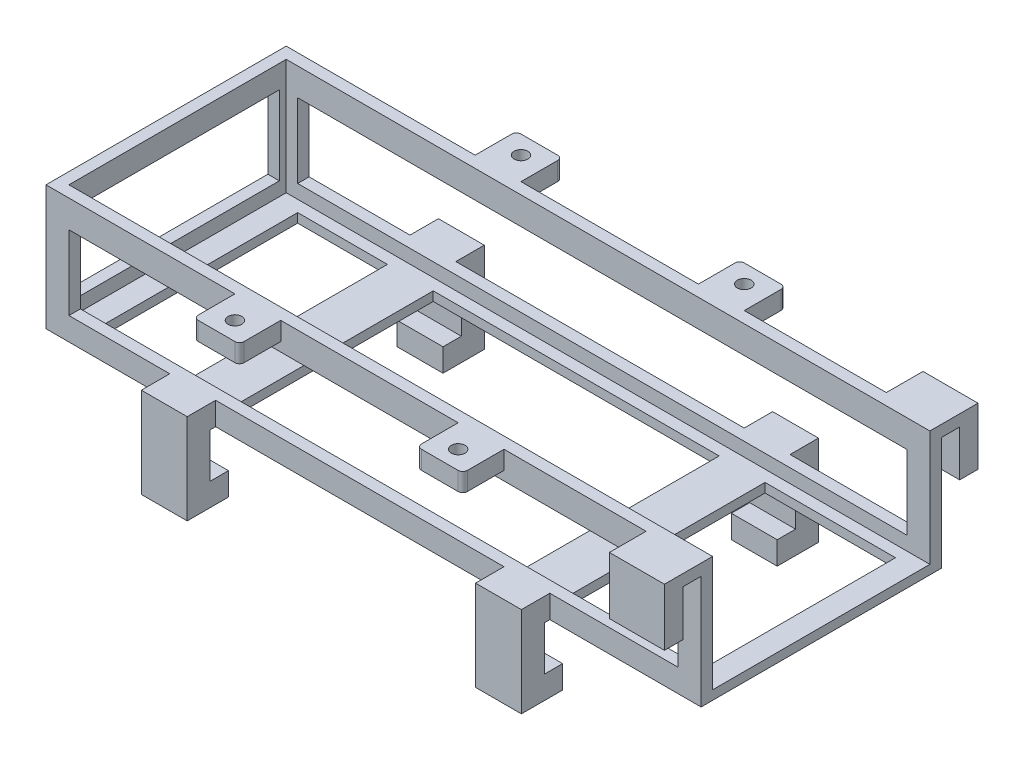
from build123d import *

# Parameters (mm, degrees)
SKETCH1_W            = 145.4
SKETCH1_H            = 52.4
BOSS_EXTRUDE1_DEPTH  = 27.2
SKETCH2_W            = 140.4
SKETCH2_H            = 47.4
CUT_EXTRUDE1_DEPTH   = 25.2
SKETCH3_W            = 46.4
SKETCH3_H            = 25.2
CUT_EXTRUDE2_DEPTH   = 25.2
SKETCH8_W            = 2.5
SKETCH8_H            = 52.4
CUT_EXTRUDE5_DEPTH   = 43
SKETCH9_W            = 44.4
SKETCH9_H            = 17.2
CUT_EXTRUDE6_DEPTH   = 43
SKETCH11_W           = 132.9
SKETCH11_H           = 16.2
CUT_EXTRUDE7_DEPTH   = 59
SKETCH12_W           = 130.4
SKETCH12_H           = 42.4
CUT_EXTRUDE8_DEPTH   = 10
SKETCH16_W           = 12
SKETCH16_H           = 2.5
BOSS_EXTRUDE4_DEPTH  = 8
SKETCH18_W           = 12
SKETCH18_H           = 2.5
BOSS_EXTRUDE6_DEPTH  = 8
SKETCH24_W           = 10
SKETCH24_H           = 5
BOSS_EXTRUDE12_DEPTH = 6.2
SKETCH25_W           = 10
SKETCH25_H           = 5
BOSS_EXTRUDE13_DEPTH = 6.2
SKETCH26_W           = 10
SKETCH26_H           = 5
BOSS_EXTRUDE14_DEPTH = 9.7
SKETCH27_W           = 10
SKETCH27_H           = 9
BOSS_EXTRUDE15_DEPTH = 5
SKETCH28_W           = 10
SKETCH28_H           = 2
BOSS_EXTRUDE16_DEPTH = 42.4
SKETCH29_W           = 10
SKETCH29_H           = 2
BOSS_EXTRUDE17_DEPTH = 42.4
SKETCH30_W           = 12
SKETCH30_H           = 4
BOSS_EXTRUDE18_DEPTH = 10
SKETCH35_W           = 10
SKETCH35_H           = 6
BOSS_EXTRUDE22_DEPTH = 9
SKETCH36_W           = 10
SKETCH36_H           = 6
BOSS_EXTRUDE23_DEPTH = 9
SKETCH37_R           = 1.5
CUT_EXTRUDE10_DEPTH  = 9
SKETCH38_W           = 10
SKETCH38_H           = 2
CUT_EXTRUDE11_DEPTH  = 9
SKETCH39_W           = 10
SKETCH39_H           = 2
CUT_EXTRUDE12_DEPTH  = 9
SKETCH40_W           = 10
SKETCH40_H           = 2
CUT_EXTRUDE13_DEPTH  = 9
FILLET1_R            = 1


with BuildPart() as part:
    # Sketch1 → Boss-Extrude1 (new body)
    with BuildSketch(Plane(origin=(0, 0, 0), x_dir=(1, 0, 0), z_dir=(0, 1, 0))):
        Rectangle(SKETCH1_W, SKETCH1_H)
    extrude(amount=BOSS_EXTRUDE1_DEPTH)

    # Sketch2 → Cut-Extrude1 (cut)
    with BuildSketch(Plane(origin=(0, 27.2, 0), x_dir=(1, 0, 0), z_dir=(0, 1, 0))):
        Rectangle(SKETCH2_W, SKETCH2_H)
    extrude(amount=-CUT_EXTRUDE1_DEPTH, mode=Mode.SUBTRACT)

    # Sketch3 → Cut-Extrude2 (cut)
    with BuildSketch(Plane.ZY.offset(-70.2)):
        with Locations((0.5, 14.6)):
            Rectangle(SKETCH3_W, SKETCH3_H)
    extrude(amount=-CUT_EXTRUDE2_DEPTH, mode=Mode.SUBTRACT)

    # Sketch8 → Cut-Extrude5 (cut)
    with BuildSketch(Plane(origin=(0, 27.2, 0), x_dir=(1, 0, 0), z_dir=(0, 1, 0))):
        with Locations((71.45, 0)):
            Rectangle(SKETCH8_W, SKETCH8_H)
    extrude(amount=-CUT_EXTRUDE5_DEPTH, mode=Mode.SUBTRACT)

    # Sketch9 → Cut-Extrude6 (cut)
    with BuildSketch(Plane.ZY.offset(72.7)):
        with Locations((0, 13.6)):
            Rectangle(SKETCH9_W, SKETCH9_H)
    extrude(amount=-CUT_EXTRUDE6_DEPTH, mode=Mode.SUBTRACT)

    # Sketch11 → Cut-Extrude7 (cut)
    with BuildSketch(Plane(origin=(0, 0, -26.2), x_dir=(-1, 0, 0), z_dir=(0, 0, -1))):
        with Locations((1.25, 13.1)):
            Rectangle(SKETCH11_W, SKETCH11_H)
    extrude(amount=-CUT_EXTRUDE7_DEPTH, mode=Mode.SUBTRACT)

    # Sketch12 → Cut-Extrude8 (cut)
    with BuildSketch(Plane(origin=(0, 0, 0), x_dir=(-1, 0, 0), z_dir=(0, -1, 0))):
        Rectangle(SKETCH12_W, SKETCH12_H)
    extrude(amount=-CUT_EXTRUDE8_DEPTH, mode=Mode.SUBTRACT)

    # Sketch16 → Boss-Extrude4 (add)
    with BuildSketch(Plane(origin=(0, 0, -26.2), x_dir=(-1, 0, 0), z_dir=(0, 0, -1))):
        with Locations((-64.2, 25.95)):
            Rectangle(SKETCH16_W, SKETCH16_H)
    extrude(amount=BOSS_EXTRUDE4_DEPTH)

    # Sketch18 → Boss-Extrude6 (add)
    with BuildSketch(Plane.XY.offset(26.2)):
        with Locations((64.2, 25.95)):
            Rectangle(SKETCH18_W, SKETCH18_H)
    extrude(amount=BOSS_EXTRUDE6_DEPTH)

    # Sketch24 → Boss-Extrude12 (add)
    with BuildSketch(Plane.XY.offset(26.2)):
        with Locations((-40.7, 2.5)):
            Rectangle(SKETCH24_W, SKETCH24_H)
        with Locations((32.2, 2.5)):
            Rectangle(SKETCH24_W, SKETCH24_H)
    extrude(amount=BOSS_EXTRUDE12_DEPTH)

    # Sketch25 → Boss-Extrude13 (add)
    with BuildSketch(Plane(origin=(0, 0, -26.2), x_dir=(-1, 0, 0), z_dir=(0, 0, -1))):
        with Locations((40.7, 2.5)):
            Rectangle(SKETCH25_W, SKETCH25_H)
        with Locations((-32.2, 2.5)):
            Rectangle(SKETCH25_W, SKETCH25_H)
    extrude(amount=BOSS_EXTRUDE13_DEPTH)

    # Sketch26 → Boss-Extrude14 (add)
    with BuildSketch(Plane(origin=(0, 0, 0), x_dir=(-1, 0, 0), z_dir=(0, -1, 0))):
        with Locations((40.7, 29.9)):
            Rectangle(SKETCH26_W, SKETCH26_H)
        with Locations((40.7, -29.9)):
            Rectangle(SKETCH26_W, SKETCH26_H)
        with Locations((-32.2, -29.9)):
            Rectangle(SKETCH26_W, SKETCH26_H)
        with Locations((-32.2, 29.9)):
            Rectangle(SKETCH26_W, SKETCH26_H)
    extrude(amount=BOSS_EXTRUDE14_DEPTH)

    # Sketch27 → Boss-Extrude15 (add)
    with BuildSketch(Plane(origin=(0, -9.7, 0), x_dir=(-1, 0, 0), z_dir=(0, -1, 0))):
        with Locations((40.7, -27.9)):
            Rectangle(SKETCH27_W, SKETCH27_H)
        with Locations((-32.2, -27.9)):
            Rectangle(SKETCH27_W, SKETCH27_H)
        with Locations((40.7, 27.9)):
            Rectangle(SKETCH27_W, SKETCH27_H)
        with Locations((-32.2, 27.9)):
            Rectangle(SKETCH27_W, SKETCH27_H)
    extrude(amount=BOSS_EXTRUDE15_DEPTH)

    # Sketch28 → Boss-Extrude16 (add)
    with BuildSketch(Plane.XY.offset(-21.2)):
        with Locations((-40.62922207, 1)):
            Rectangle(SKETCH28_W, SKETCH28_H)
    extrude(amount=BOSS_EXTRUDE16_DEPTH)

    # Sketch29 → Boss-Extrude17 (add)
    with BuildSketch(Plane.XY.offset(-21.2)):
        with Locations((31.742427041, 1)):
            Rectangle(SKETCH29_W, SKETCH29_H)
    extrude(amount=BOSS_EXTRUDE17_DEPTH)

    # Sketch30 → Boss-Extrude18 (add)
    with BuildSketch(Plane(origin=(0, 24.7, 0), x_dir=(-1, 0, 0), z_dir=(0, -1, 0))):
        with Locations((-64.2, -32.2)):
            Rectangle(SKETCH30_W, SKETCH30_H)
        with Locations((-64.2, 32.2)):
            Rectangle(SKETCH30_W, SKETCH30_H)
    extrude(amount=BOSS_EXTRUDE18_DEPTH)

    # Sketch35 → Boss-Extrude22 (add)
    with BuildSketch(Plane(origin=(0, 0, -26.2), x_dir=(-1, 0, 0), z_dir=(0, 0, -1))):
        with Locations((-22.214363523, 24.2)):
            Rectangle(SKETCH35_W, SKETCH35_H)
        with Locations((26.494707746, 24.2)):
            Rectangle(SKETCH35_W, SKETCH35_H)
    extrude(amount=BOSS_EXTRUDE22_DEPTH)

    # Sketch36 → Boss-Extrude23 (add)
    with BuildSketch(Plane.XY.offset(26.2)):
        with Locations((-26.49, 24.2)):
            Rectangle(SKETCH36_W, SKETCH36_H)
        with Locations((22.21, 24.2)):
            Rectangle(SKETCH36_W, SKETCH36_H)
    extrude(amount=BOSS_EXTRUDE23_DEPTH)

    # Sketch37 → Cut-Extrude10 (cut)
    with BuildSketch(Plane.XZ.offset(-21.2)):
        with Locations(Location((-26.49, 31.2, 0), (0, 0, 270))):
            Circle(SKETCH37_R)
        with Locations(Location((22.21, 31.2, 0), (0, 0, 270))):
            Circle(SKETCH37_R)
        with Locations(Location((-26.49, -31.2, 0), (0, 0, 270))):
            Circle(SKETCH37_R)
        with Locations(Location((22.214363523, -31.2, 0), (0, 0, 270))):
            Circle(SKETCH37_R)
    extrude(amount=-CUT_EXTRUDE10_DEPTH, mode=Mode.SUBTRACT)

    # Sketch38 → Cut-Extrude11 (cut)
    with BuildSketch(Plane.XY.offset(35.2)):
        with Locations((-26.49, 22.2)):
            Rectangle(SKETCH38_W, SKETCH38_H)
    extrude(amount=-CUT_EXTRUDE11_DEPTH, mode=Mode.SUBTRACT)

    # Sketch39 → Cut-Extrude12 (cut)
    with BuildSketch(Plane.XY.offset(35.2)):
        with Locations((22.21, 22.2)):
            Rectangle(SKETCH39_W, SKETCH39_H)
    extrude(amount=-CUT_EXTRUDE12_DEPTH, mode=Mode.SUBTRACT)

    # Sketch40 → Cut-Extrude13 (cut)
    with BuildSketch(Plane(origin=(0, 0, -35.2), x_dir=(-1, 0, 0), z_dir=(0, 0, -1))):
        with Locations((-22.214363523, 22.2)):
            Rectangle(SKETCH40_W, SKETCH40_H)
        with Locations((26.494707746, 22.2)):
            Rectangle(SKETCH40_W, SKETCH40_H)
    extrude(amount=-CUT_EXTRUDE13_DEPTH, mode=Mode.SUBTRACT)

    # Fillet1
    fillet1_edges = [part.edges().sort_by_distance(p)[0] for p in [
        (27.214363523, 25.2, -35.2),
        (-21.494707746, 25.2, -35.2),
        (-31.49, 25.2, 35.2),
        (17.21, 25.2, 35.2),
        (-21.49, 25.2, 35.2),
        (27.21, 25.2, 35.2),
        (-31.494707746, 25.2, -35.2),
        (17.214363523, 25.2, -35.2),
    ]]
    fillet(fillet1_edges, radius=FILLET1_R)


solid = part.part
